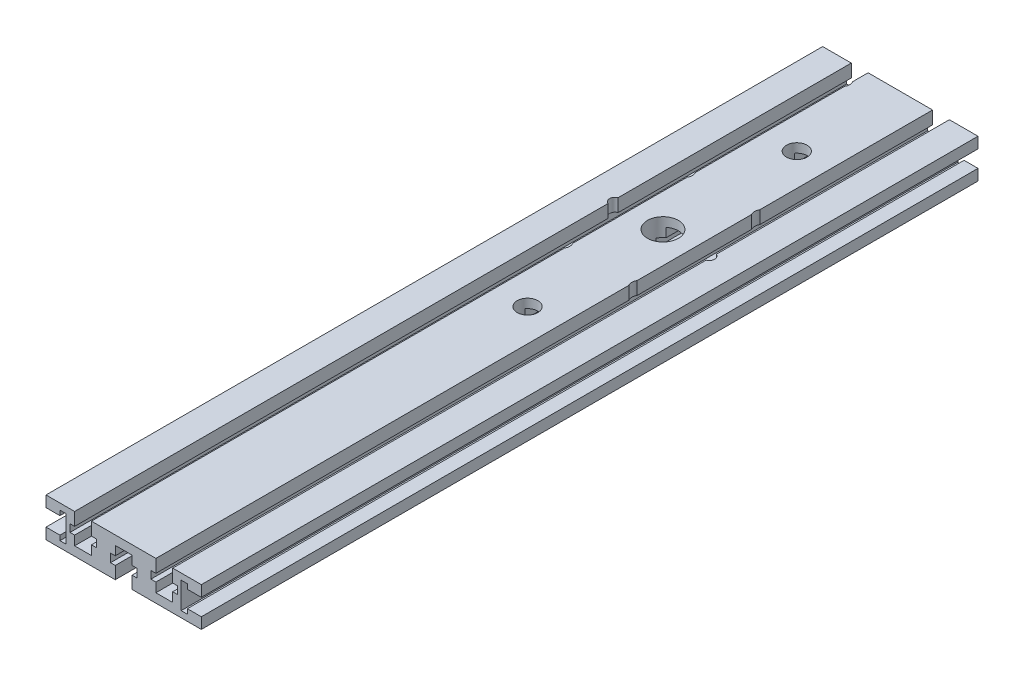
from build123d import *

# Parameters (mm, degrees)
EXTRUDE_1_DEPTH         = 300
HOLE_WIZARD_12_0_12_1_D = 12
HOLE_WIZARD_8_0_8_1_D   = 8
HOLE_WIZARD_6_0_6_2_D   = 6
HOLE_WIZARD_M5_1_D      = 4.2


with BuildPart() as part:
    # 草图1 → 凸台-拉伸1 (new body)
    with BuildSketch(Plane.XY):
        Polygon((0, 0), (26.75, 0), (26.75, 4.796419132), (24.926505169, 4.796419132), (24.926505169, 8.023402897), (26.75, 8.023402897), (26.75, 11.5), (30, 11.5), (33.25, 11.5), (33.25, 8.023402897), (35.073494831, 8.023402897), (35.073494831, 4.796419132), (33.25, 4.796419132), (33.25, 0), (60, 0), (60, 4.25), (54.613325713, 4.25), (54.613325713, 2.4), (52.2, 2.4), (52.2, 12.6), (54.613325713, 12.6), (54.613325713, 10.75), (60, 10.75), (60, 15), (48.947608979, 15), (48.947608979, 10.003848618), (50.733802833, 10.003848618), (50.733802833, 7.094693738), (48.947608979, 7.094693738), (48.947608979, 3.5), (42.447608979, 3.5), (42.447608979, 7.094693738), (40.533802833, 7.094693738), (40.533802833, 10.003848618), (42.447608979, 10.003848618), (42.447608979, 15), (30, 15), (17.552391021, 15), (17.552391021, 10.003848618), (19.466197167, 10.003848618), (19.466197167, 7.094693738), (17.552391021, 7.094693738), (17.552391021, 3.5), (11.052391021, 3.5), (11.052391021, 7.094693738), (9.266197167, 7.094693738), (9.266197167, 10.003848618), (11.052391021, 10.003848618), (11.052391021, 15), (0, 15), (0, 10.75), (5.386674287, 10.75), (5.386674287, 12.6), (7.8, 12.6), (7.8, 2.4), (5.386674287, 2.4), (5.386674287, 4.25), (0, 4.25), align=None)
    extrude(amount=EXTRUDE_1_DEPTH)

    # Ø12.0 (12) 直径孔1 (through all)
    with Locations(Plane(origin=(0, 15, 0), x_dir=(1, 0, 0), z_dir=(0, 1, 0))):
        with Locations((30.31545922, -92)):
            Hole(HOLE_WIZARD_12_0_12_1_D / 2)

    # Ø8.0 (8) 直径孔1 (through all)
    with Locations(Plane(origin=(0, 15, 0), x_dir=(1, 0, 0), z_dir=(0, 1, 0))):
        with Locations((30, -40), (30, -144)):
            Hole(HOLE_WIZARD_8_0_8_1_D / 2)

    # Ø6.0 (6) 直径孔2 (through all)
    with Locations(Plane(origin=(0, 0, 0), x_dir=(-1, 0, 0), z_dir=(0, -1, 0))):
        with Locations((-15, -7.5), (-15, -68.3), (-15, -115.7), (-45, -68.3), (-45, -115.7)):
            Hole(HOLE_WIZARD_6_0_6_2_D / 2)

    # M5 螺纹孔的螺纹孔钻头1 (through all)
    with Locations(Plane(origin=(0, 0, 0), x_dir=(-1, 0, 0), z_dir=(0, -1, 0))):
        with Locations((-48.2, -92), (-11.8, -92)):
            Hole(HOLE_WIZARD_M5_1_D / 2)


solid = part.part
